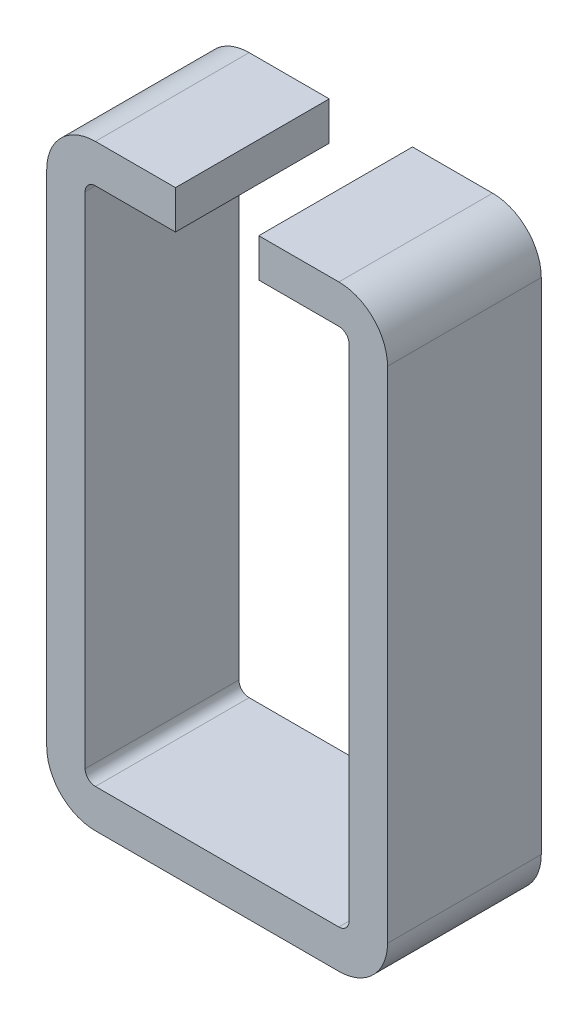
from build123d import *

# Parameters (mm, degrees)
BOSS_EXTRUDE1_DEPTH = 12


with BuildPart() as part:
    # Sketch1 → Boss-Extrude1 (new body)
    with BuildSketch(Plane.XY):
        with BuildLine():
            Line((-4.455735931, 20.3), (-3.25, 20.3))
            Line((-3.25, 20.3), (-3.25, 23.3))
            Line((-3.25, 23.3), (-4.455735931, 23.3))
            Line((-4.455735931, 23.3), (-9.5, 23.3))
            ThreePointArc((-9.5, 23.3), (-12.187005769, 22.187005769), (-13.3, 19.5))
            Line((-13.3, 19.5), (-13.3, 14.455735931))
            Line((-13.3, 14.455735931), (-13.3, 5.544264069))
            Line((-13.3, 5.544264069), (-13.3, -5.544264069))
            Line((-13.3, -5.544264069), (-13.3, -14.455735931))
            Line((-13.3, -14.455735931), (-13.3, -19.5))
            ThreePointArc((-13.3, -19.5), (-12.187005769, -22.187005769), (-9.5, -23.3))
            Line((-9.5, -23.3), (-4.455735931, -23.3))
            Line((-4.455735931, -23.3), (4.455735931, -23.3))
            Line((4.455735931, -23.3), (9.5, -23.3))
            ThreePointArc((9.5, -23.3), (12.187005769, -22.187005769), (13.3, -19.5))
            Line((13.3, -19.5), (13.3, -14.455735931))
            Line((13.3, -14.455735931), (13.3, -5.544264069))
            Line((13.3, -5.544264069), (13.3, 5.544264069))
            Line((13.3, 5.544264069), (13.3, 14.455735931))
            Line((13.3, 14.455735931), (13.3, 19.5))
            ThreePointArc((13.3, 19.5), (12.187005769, 22.187005769), (9.5, 23.3))
            Line((9.5, 23.3), (4.455735931, 23.3))
            Line((4.455735931, 23.3), (3.25, 23.3))
            Line((3.25, 23.3), (3.25, 20.3))
            Line((3.25, 20.3), (4.455735931, 20.3))
            Line((4.455735931, 20.3), (9.5, 20.3))
            ThreePointArc((9.5, 20.3), (10.065685425, 20.065685425), (10.3, 19.5))
            Line((10.3, 19.5), (10.3, 14.455735931))
            Line((10.3, 14.455735931), (10.3, 5.544264069))
            Line((10.3, 5.544264069), (10.3, -5.544264069))
            Line((10.3, -5.544264069), (10.3, -14.455735931))
            Line((10.3, -14.455735931), (10.3, -19.5))
            ThreePointArc((10.3, -19.5), (10.065685425, -20.065685425), (9.5, -20.3))
            Line((9.5, -20.3), (4.455735931, -20.3))
            Line((4.455735931, -20.3), (-4.455735931, -20.3))
            Line((-4.455735931, -20.3), (-9.5, -20.3))
            ThreePointArc((-9.5, -20.3), (-10.065685425, -20.065685425), (-10.3, -19.5))
            Line((-10.3, -19.5), (-10.3, -14.455735931))
            Line((-10.3, -14.455735931), (-10.3, -5.544264069))
            Line((-10.3, -5.544264069), (-10.3, 5.544264069))
            Line((-10.3, 5.544264069), (-10.3, 14.455735931))
            Line((-10.3, 14.455735931), (-10.3, 19.5))
            ThreePointArc((-10.3, 19.5), (-10.065685425, 20.065685425), (-9.5, 20.3))
            Line((-9.5, 20.3), (-4.455735931, 20.3))
        make_face()
    extrude(amount=-BOSS_EXTRUDE1_DEPTH)


solid = part.part
